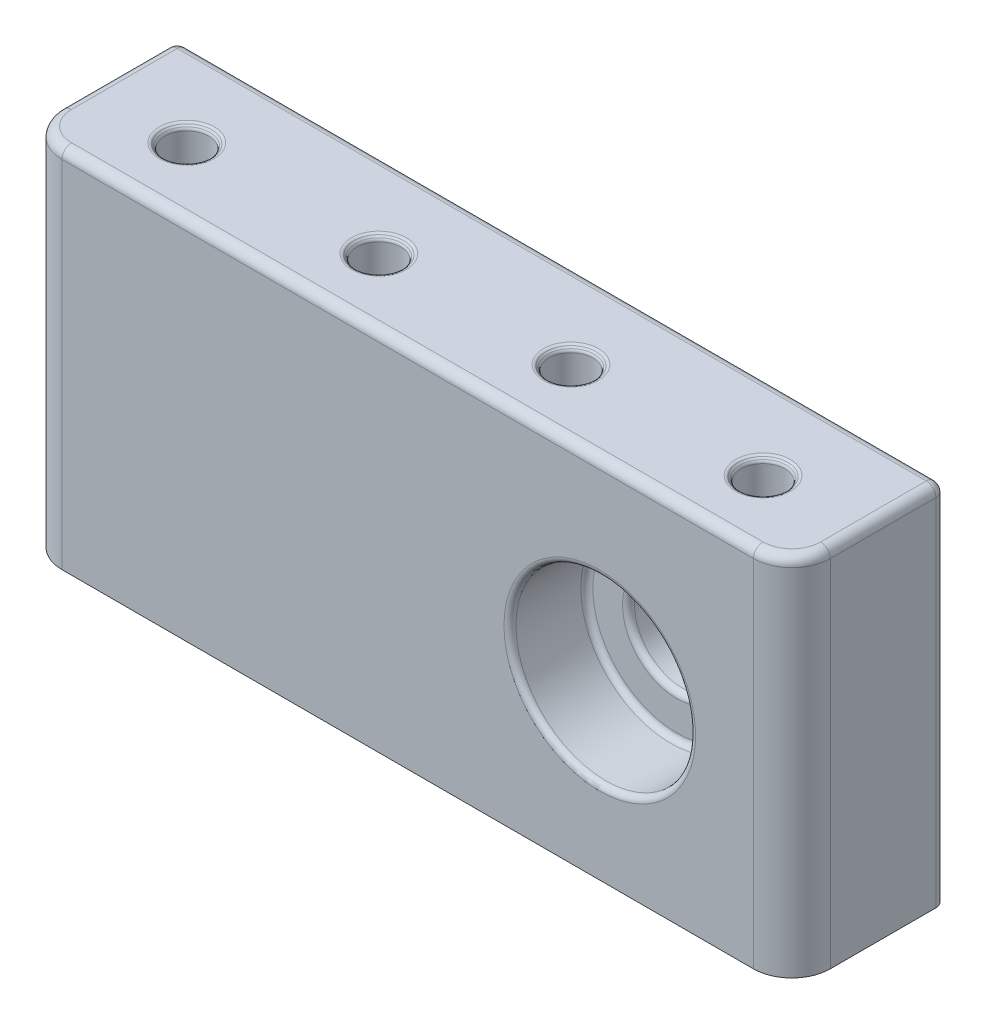
from build123d import *

# Parameters (mm, degrees)
SKETCH2_W           = 40
SKETCH2_H           = 19
BOSS_EXTRUDE1_DEPTH = 8
FILLET1_R           = 2
SKETCH5_R           = 1.15
CUT_EXTRUDE3_DEPTH  = 7
CHAMFER1_SIZE       = 0.2
FILLET5_R           = 0.2
FILLET2_R           = 0.5
SKETCH3_R           = 4.675
CUT_EXTRUDE1_DEPTH  = 4
SKETCH4_R           = 2.5
CUT_EXTRUDE2_DEPTH  = 4
CHAMFER3_SIZE       = 1.5
FILLET4_R           = 0.3125


with BuildPart() as part:
    # Sketch2 → Boss-Extrude1 (new body)
    with BuildSketch(Plane.XY):
        Rectangle(SKETCH2_W, SKETCH2_H)
    extrude(amount=BOSS_EXTRUDE1_DEPTH)

    # Fillet1
    fillet1_edges = [part.edges().sort_by_distance(p)[0] for p in [
        (-20, 0, 8),
        (20, 0, 8),
    ]]
    fillet(fillet1_edges, radius=FILLET1_R)

    # Sketch5 → Cut-Extrude3 (cut)
    with BuildSketch(Plane(origin=(0, 9.5, 0), x_dir=(1, 0, 0), z_dir=(0, 1, 0))):
        with Locations(Location((-15, -4.5, 0), (0, 0, 270))):
            Circle(SKETCH5_R)
        with Locations(Location((-5, -4.5, 0), (0, 0, 270))):
            Circle(SKETCH5_R)
        with Locations(Location((5, -4.5, 0), (0, 0, 270))):
            Circle(SKETCH5_R)
        with Locations(Location((15, -4.5, 0), (0, 0, 270))):
            Circle(SKETCH5_R)
    extrude(amount=-CUT_EXTRUDE3_DEPTH, mode=Mode.SUBTRACT)

    # Chamfer1
    chamfer1_edges = [part.edges().sort_by_distance(p)[0] for p in [
        (-15, 2.5, 3.35),
        (-15, 9.5, 3.35),
        (-5, 2.5, 3.35),
        (-5, 9.5, 3.35),
        (5, 2.5, 3.35),
        (5, 9.5, 3.35),
        (15, 2.5, 3.35),
        (15, 9.5, 3.35),
    ]]
    chamfer(chamfer1_edges, length=CHAMFER1_SIZE)

    # Fillet5
    fillet5_edges = [part.edges().sort_by_distance(p)[0] for p in [
        (15, 9.3, 3.35),
        (-15, 9.5, 3.15),
        (-5, 9.5, 3.15),
        (5, 9.5, 3.15),
        (15, 9.5, 3.15),
        (5, 9.3, 3.35),
        (-5, 9.3, 3.35),
        (-15, 9.3, 3.35),
    ]]
    fillet(fillet5_edges, radius=FILLET5_R)

    # Fillet2
    fillet2_edges = [part.edges().sort_by_distance(p)[0] for p in [
        (0, 9.5, 8),
        (-20, 9.5, 3),
        (20, 9.5, 3),
        (-19.414213562, 9.5, 7.414213562),
        (19.414213562, 9.5, 7.414213562),
        (-20, 0, 0),
        (0, 9.5, 0),
        (20, 0, 0),
    ]]
    fillet(fillet2_edges, radius=FILLET2_R)

    # Sketch3 → Cut-Extrude1 (cut)
    with BuildSketch(Plane.XY.offset(8)):
        with Locations((10, -0.5)):
            Circle(SKETCH3_R)
    extrude(amount=-CUT_EXTRUDE1_DEPTH, mode=Mode.SUBTRACT)

    # Sketch4 → Cut-Extrude2 (cut)
    with BuildSketch(Plane.XY.offset(4)):
        with Locations((10, -0.5)):
            Circle(SKETCH4_R)
    extrude(amount=-CUT_EXTRUDE2_DEPTH, mode=Mode.SUBTRACT)

    # Chamfer3
    chamfer3_edges = [part.edges().sort_by_distance(p)[0] for p in [
        (7.5, -0.5, 0),
    ]]
    chamfer(chamfer3_edges, length=CHAMFER3_SIZE)

    # Fillet4
    fillet4_edges = [part.edges().sort_by_distance(p)[0] for p in [
        (5.325, -0.5, 4),
        (5.325, -0.5, 8),
        (7.5, -0.5, 4),
        (6, -0.5, 0),
        (7.5, -0.5, 1.5),
    ]]
    fillet(fillet4_edges, radius=FILLET4_R)


solid = part.part
